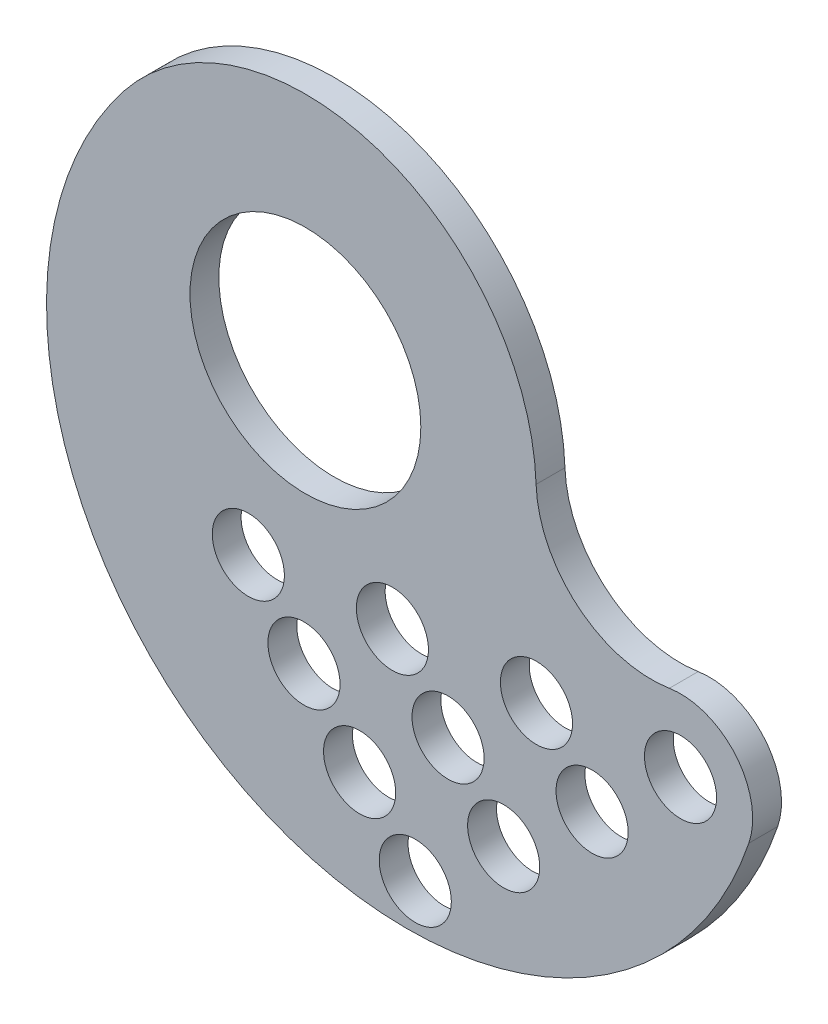
from build123d import *

# Parameters (mm, degrees)
CROQUIS1_R              = 40
CROQUIS1_R_2            = 12.5
SALIENTE_EXTRUIR1_DEPTH = 10


with BuildPart() as part:
    # Croquis1 → Saliente-Extruir1 (new body)
    with BuildSketch(Plane.XY):
        with BuildLine():
            ThreePointArc((79.950643702, 2.809728022), (24.958439712, 76.007080507), (-62.721500941, 49.658970184))
            ThreePointArc((-62.721500941, 49.658970184), (-24.43428434, -137.747119815), (153.67978893, -68.016707318))
            ThreePointArc((153.67978893, -68.016707318), (149.121265752, -43.894808413), (126.125371367, -35.302079987))
            ThreePointArc((126.125371367, -35.302079987), (94.463628593, -26.634547282), (79.950643702, 2.809728022))
        make_face()
        Circle(CROQUIS1_R, mode=Mode.SUBTRACT)
        with Locations((130, -60)):
            Circle(CROQUIS1_R_2, mode=Mode.SUBTRACT)
        with Locations((99.358222275, -85.711504387)):
            Circle(CROQUIS1_R_2, mode=Mode.SUBTRACT)
        with Locations((68.71644455, -111.423008775)):
            Circle(CROQUIS1_R_2, mode=Mode.SUBTRACT)
        with Locations((38.074666826, -137.134513162)):
            Circle(CROQUIS1_R_2, mode=Mode.SUBTRACT)
        with Locations((80.074593985, -62.730171094)):
            Circle(CROQUIS1_R_2, mode=Mode.SUBTRACT)
        with Locations((49.43281626, -88.441675481)):
            Circle(CROQUIS1_R_2, mode=Mode.SUBTRACT)
        with Locations((18.791038535, -114.153179869)):
            Circle(CROQUIS1_R_2, mode=Mode.SUBTRACT)
        with Locations((30.149187969, -65.460342188)):
            Circle(CROQUIS1_R_2, mode=Mode.SUBTRACT)
        with Locations((-0.492589755, -91.171846575)):
            Circle(CROQUIS1_R_2, mode=Mode.SUBTRACT)
        with Locations((-19.776218046, -68.190513282)):
            Circle(CROQUIS1_R_2, mode=Mode.SUBTRACT)
    extrude(amount=SALIENTE_EXTRUIR1_DEPTH)


solid = part.part
